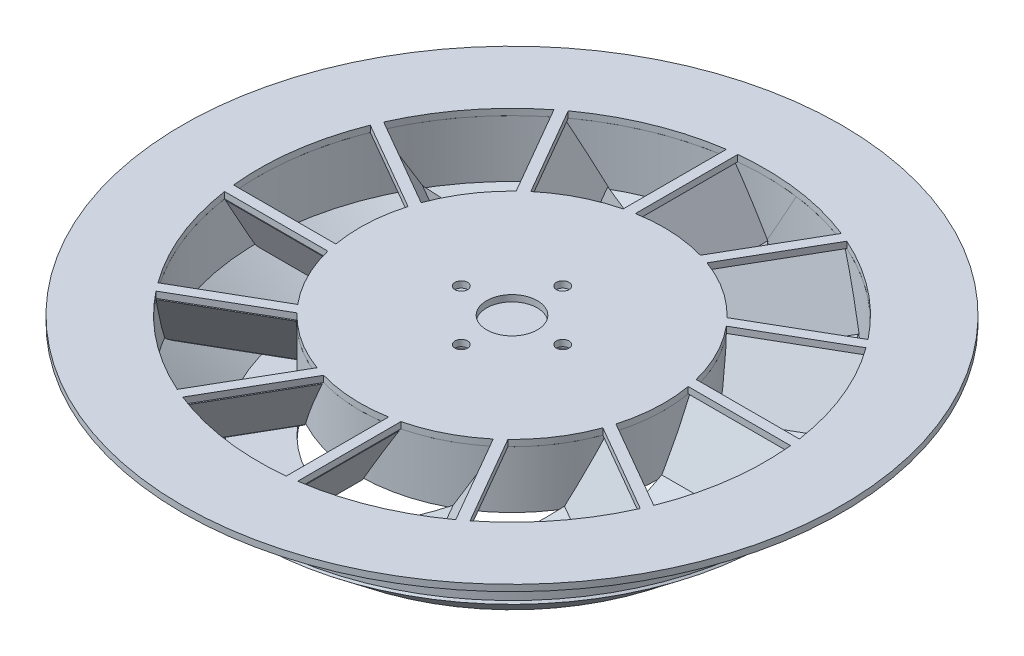
from build123d import *

# Parameters (mm, degrees)
SKETCH3_R                 = 38.1
SKETCH3_R_2               = 6.35
BOSS_EXTRUDE3_DEPTH       = 1.5875
SKETCH4_R                 = 50.8
SKETCH4_R_2               = 38.1
BOSS_EXTRUDE4_DEPTH       = 1.5875
BOSS_EXTRUDE7_DEPTH       = 0.79375
BOSS_EXTRUDE7_DEPTH_BACK  = 0.79375
CIRPATTERN1_COUNT         = 12
BOSS_EXTRUDE9_DEPTH       = 12.7
BOSS_EXTRUDE9_DEPTH_BACK  = 1.5875
SKETCH11_R                = 65.0875
SKETCH11_R_2              = 63.5
SKETCH11_R_3              = 38.1
SKETCH11_R_4              = 36.5125
BOSS_EXTRUDE10_DEPTH      = 0.79375
BOSS_EXTRUDE10_DEPTH_BACK = 0.79375
CIRPATTERN4_COUNT         = 12
SKETCH14_R                = 82.55
SKETCH14_R_2              = 6.35
BOSS_EXTRUDE12_DEPTH      = 1.5875
HOLE1_AT_2_COUNT          = 2
HOLE1_AT_2_PITCH          = 17.960512242
HOLE1_AT_3_COUNT          = 2
HOLE1_AT_3_PITCH          = 25.4
HOLE1_AT_4_COUNT          = 2
HOLE1_AT_4_PITCH          = 17.960512242


with BuildPart() as part:
    # Sketch3 → Boss-Extrude3 (new body)
    with BuildSketch(Plane(origin=(0, 0, 0), x_dir=(1, 0, 0), z_dir=(0, 1, 0))):
        Circle(SKETCH3_R)
        Circle(SKETCH3_R_2, mode=Mode.SUBTRACT)
    extrude(amount=BOSS_EXTRUDE3_DEPTH)

    # Sketch11 → Boss-Extrude9 (add, two sides: drawn at the far end of the back side and taken through both)
    # profile 1 of 2: a face of its own
    with BuildSketch(Plane(origin=(0, 1.5875, 0), x_dir=(1, 0, 0), z_dir=(0, 1, 0)).offset(-BOSS_EXTRUDE9_DEPTH_BACK)):
        Circle(SKETCH11_R)
        Circle(SKETCH11_R_2, mode=Mode.SUBTRACT)
    # profile 2 of 2: a face of its own
    with BuildSketch(Plane(origin=(0, 1.5875, 0), x_dir=(1, 0, 0), z_dir=(0, 1, 0)).offset(-BOSS_EXTRUDE9_DEPTH_BACK)):
        Circle(SKETCH11_R_3)
        Circle(SKETCH11_R_4, mode=Mode.SUBTRACT)
    extrude(amount=BOSS_EXTRUDE9_DEPTH + BOSS_EXTRUDE9_DEPTH_BACK)


with BuildPart() as body_2:
    # Sketch4 → Boss-Extrude4 (new body)
    with BuildSketch(Plane(origin=(0, -10.16, 0), x_dir=(1, 0, 0), z_dir=(0, 1, 0))):
        Circle(SKETCH4_R)
        Circle(SKETCH4_R_2, mode=Mode.SUBTRACT)
    extrude(amount=-BOSS_EXTRUDE4_DEPTH)


with BuildPart() as body_3:
    # Sketch5 → Revolve1 (revolve)
    with BuildSketch(Plane(origin=(0, 0, 0), x_dir=(0, 0, -1), z_dir=(1, 0, 0))):
        Polygon((64.491703388, -1.239629235), (63.5, 0), (50.8, -10.16), (51.791703388, -11.399629235), align=None)
    revolve(axis=Axis((0, -12.41425, 0), (0, 1, 0)))


with BuildPart() as body_4:
    # Sketch10 → Boss-Extrude7 (new, two sides: drawn at the far end of the back side and taken through both)
    with BuildSketch(Plane(origin=(0, 0, 0), x_dir=(0, 0, 1), z_dir=(0.5000000000000067, -0.8660254037844348, 0)).offset(-BOSS_EXTRUDE7_DEPTH_BACK)):
        with BuildLine():
            Line((63.5, 0), (38.1, 0))
            ThreePointArc((38.1, 0), (37.01129211, 10.38577077), (33.792502127, 20.32))
            Line((33.792502127, 20.32), (47.65462412, 20.32))
            add(Edge.make_bspline(
                [(63.5, 0), (56.244791264, 11.608333978), (47.65462412, 20.32)],
                knots=[2.377033856, 2.377033856, 2.377033856, 2.595342265, 2.595342265, 2.595342265], degree=2, weights=[1, 0.994048592, 1]))
        make_face()
    extrude(amount=BOSS_EXTRUDE7_DEPTH + BOSS_EXTRUDE7_DEPTH_BACK)


with BuildPart() as cirpattern1_1:
    # CirPattern1: pattern copy
    add(body_4.part.rotate(Axis((0, -12.41425, 0), (0, 1, 0)), 1 * 360 / CIRPATTERN1_COUNT))


with BuildPart() as cirpattern1_2:
    # CirPattern1: pattern copy
    add(body_4.part.rotate(Axis((0, -12.41425, 0), (0, 1, 0)), 2 * 360 / CIRPATTERN1_COUNT))


with BuildPart() as cirpattern1_3:
    # CirPattern1: pattern copy
    add(body_4.part.rotate(Axis((0, -12.41425, 0), (0, 1, 0)), 3 * 360 / CIRPATTERN1_COUNT))


with BuildPart() as cirpattern1_4:
    # CirPattern1: pattern copy
    add(body_4.part.rotate(Axis((0, -12.41425, 0), (0, 1, 0)), 4 * 360 / CIRPATTERN1_COUNT))


with BuildPart() as cirpattern1_5:
    # CirPattern1: pattern copy
    add(body_4.part.rotate(Axis((0, -12.41425, 0), (0, 1, 0)), 5 * 360 / CIRPATTERN1_COUNT))


with BuildPart() as cirpattern1_6:
    # CirPattern1: pattern copy
    add(body_4.part.rotate(Axis((0, -12.41425, 0), (0, 1, 0)), 6 * 360 / CIRPATTERN1_COUNT))


with BuildPart() as cirpattern1_7:
    # CirPattern1: pattern copy
    add(body_4.part.rotate(Axis((0, -12.41425, 0), (0, 1, 0)), 7 * 360 / CIRPATTERN1_COUNT))


with BuildPart() as cirpattern1_8:
    # CirPattern1: pattern copy
    add(body_4.part.rotate(Axis((0, -12.41425, 0), (0, 1, 0)), 8 * 360 / CIRPATTERN1_COUNT))


with BuildPart() as cirpattern1_9:
    # CirPattern1: pattern copy
    add(body_4.part.rotate(Axis((0, -12.41425, 0), (0, 1, 0)), 9 * 360 / CIRPATTERN1_COUNT))


with BuildPart() as cirpattern1_10:
    # CirPattern1: pattern copy
    add(body_4.part.rotate(Axis((0, -12.41425, 0), (0, 1, 0)), 10 * 360 / CIRPATTERN1_COUNT))


with BuildPart() as cirpattern1_11:
    # CirPattern1: pattern copy
    add(body_4.part.rotate(Axis((0, -12.41425, 0), (0, 1, 0)), 11 * 360 / CIRPATTERN1_COUNT))


with BuildPart() as boss_extrude9_piece_1:
    # of the separate pieces the step leaves, piece 1, a body of its own (boss_extrude9_pieces)
    add(part.part.solids().sort_by_distance((38.1, 0, 0))[0])


with BuildPart() as boss_extrude9_piece_2:
    # of the separate pieces the step leaves, piece 2, a body of its own (boss_extrude9_pieces)
    add(part.part.solids().sort_by_distance((65.0875, 1.5875, 0))[0])


with BuildPart() as body_17:
    # Sketch13 → Boss-Extrude10 (new, two sides: drawn at the far end of the back side and taken through both)
    with BuildSketch(Plane(origin=(0, 0, 0), x_dir=(0, 0, 1), z_dir=(-0.8660254037844398, 0.499999999999998, 0)).offset(-BOSS_EXTRUDE10_DEPTH_BACK)):
        with BuildLine():
            Line((37.196314082, 16.497783942), (62.961939148, 16.497783942))
            add(Edge.make_bspline(
                [(63.5, 0), (63.5, 8.283988743), (62.961939148, 16.497783942)],
                knots=[4.71238898, 4.71238898, 4.71238898, 4.842660948, 4.842660948, 4.842660948], degree=2, weights=[1, 0.997879402, 1]))
            Line((63.5, 0), (38.1, 0))
            add(Edge.make_bspline(
                [(38.1, 0), (38.1, 8.347892933), (37.196314082, 16.497783942)],
                knots=[1.570796327, 1.570796327, 1.570796327, 1.789030841, 1.789030841, 1.789030841], degree=2, weights=[1, 0.994052617, 1]))
        make_face()
    extrude(amount=BOSS_EXTRUDE10_DEPTH + BOSS_EXTRUDE10_DEPTH_BACK)


with BuildPart() as cirpattern4_1:
    # CirPattern4: pattern copy
    add(body_17.part.rotate(Axis((0, -12.41425, 0), (0, 1, 0)), 1 * 360 / CIRPATTERN4_COUNT))


with BuildPart() as cirpattern4_2:
    # CirPattern4: pattern copy
    add(body_17.part.rotate(Axis((0, -12.41425, 0), (0, 1, 0)), 2 * 360 / CIRPATTERN4_COUNT))


with BuildPart() as cirpattern4_3:
    # CirPattern4: pattern copy
    add(body_17.part.rotate(Axis((0, -12.41425, 0), (0, 1, 0)), 3 * 360 / CIRPATTERN4_COUNT))


with BuildPart() as cirpattern4_4:
    # CirPattern4: pattern copy
    add(body_17.part.rotate(Axis((0, -12.41425, 0), (0, 1, 0)), 4 * 360 / CIRPATTERN4_COUNT))


with BuildPart() as cirpattern4_5:
    # CirPattern4: pattern copy
    add(body_17.part.rotate(Axis((0, -12.41425, 0), (0, 1, 0)), 5 * 360 / CIRPATTERN4_COUNT))


with BuildPart() as cirpattern4_6:
    # CirPattern4: pattern copy
    add(body_17.part.rotate(Axis((0, -12.41425, 0), (0, 1, 0)), 6 * 360 / CIRPATTERN4_COUNT))


with BuildPart() as cirpattern4_7:
    # CirPattern4: pattern copy
    add(body_17.part.rotate(Axis((0, -12.41425, 0), (0, 1, 0)), 7 * 360 / CIRPATTERN4_COUNT))


with BuildPart() as cirpattern4_8:
    # CirPattern4: pattern copy
    add(body_17.part.rotate(Axis((0, -12.41425, 0), (0, 1, 0)), 8 * 360 / CIRPATTERN4_COUNT))


with BuildPart() as cirpattern4_9:
    # CirPattern4: pattern copy
    add(body_17.part.rotate(Axis((0, -12.41425, 0), (0, 1, 0)), 9 * 360 / CIRPATTERN4_COUNT))


with BuildPart() as cirpattern4_10:
    # CirPattern4: pattern copy
    add(body_17.part.rotate(Axis((0, -12.41425, 0), (0, 1, 0)), 10 * 360 / CIRPATTERN4_COUNT))


with BuildPart() as cirpattern4_11:
    # CirPattern4: pattern copy
    add(body_17.part.rotate(Axis((0, -12.41425, 0), (0, 1, 0)), 11 * 360 / CIRPATTERN4_COUNT))


with BuildPart() as body_29:
    # Sketch14 → Boss-Extrude12 (new body)
    with BuildSketch(Plane(origin=(0, 14.2875, 0), x_dir=(1, 0, 0), z_dir=(0, 1, 0))):
        Circle(SKETCH14_R)
        Circle(SKETCH14_R_2, mode=Mode.SUBTRACT)
        with BuildLine():
            Line((-6.608984307, 63.155136976), (-6.608984307, 37.522410989))
            ThreePointArc((-6.608984307, 37.522410989), (0.836007826, 38.09082686), (8.248891971, 37.196314082))
            ThreePointArc((8.248891971, 37.196314082), (9.413773008, 36.918706339), (10.569354385, 36.604627411))
            Line((10.569354385, 36.604627411), (23.495476005, 58.993326803))
            ThreePointArc((23.495476005, 58.993326803), (8.695893655, 62.901760178), (-6.608984307, 63.155136976))
        make_face(mode=Mode.SUBTRACT)
        with BuildLine():
            Line((-9.148984307, 62.837457668), (-9.148984307, 36.985214426))
            ThreePointArc((-9.148984307, 36.985214426), (-17.262532838, 33.964907773), (-24.484753797, 29.190868974))
            Line((-24.484753797, 29.190868974), (-37.301116791, 51.389460847))
            ThreePointArc((-37.301116791, 51.389460847), (-23.920015276, 58.822469085), (-9.148984307, 62.837457668))
        make_face(mode=Mode.SUBTRACT)
        with BuildLine():
            Line((25.854020185, 57.998445154), (13.037657192, 35.799853281))
            ThreePointArc((13.037657192, 35.799853281), (20.78320655, 31.932245858), (27.455643104, 26.415860042))
            Line((27.455643104, 26.415860042), (49.844342496, 39.341981662))
            ThreePointArc((49.844342496, 39.341981662), (38.981744903, 50.12657543), (25.854020185, 57.998445154))
        make_face(mode=Mode.SUBTRACT)
        with BuildLine():
            Line((51.389460847, 37.301116791), (29.190868974, 24.484753797))
            ThreePointArc((29.190868974, 24.484753797), (33.964907773, 17.262532838), (36.985214426, 9.148984307))
            Line((36.985214426, 9.148984307), (62.837457668, 9.148984307))
            ThreePointArc((62.837457668, 9.148984307), (58.822469085, 23.920015276), (51.389460847, 37.301116791))
        make_face(mode=Mode.SUBTRACT)
        with BuildLine():
            Line((63.155136976, 6.608984307), (37.522410989, 6.608984307))
            ThreePointArc((37.522410989, 6.608984307), (38.045739387, -2.032661915), (36.604627411, -10.569354385))
            Line((36.604627411, -10.569354385), (58.993326803, -23.495476005))
            ThreePointArc((58.993326803, -23.495476005), (62.901760178, -8.695893655), (63.155136976, 6.608984307))
        make_face(mode=Mode.SUBTRACT)
        with BuildLine():
            Line((57.998445154, -25.854020185), (35.799853281, -13.037657192))
            ThreePointArc((35.799853281, -13.037657192), (31.932245858, -20.78320655), (26.415860042, -27.455643104))
            Line((26.415860042, -27.455643104), (39.341981662, -49.844342496))
            ThreePointArc((39.341981662, -49.844342496), (50.12657543, -38.981744903), (57.998445154, -25.854020185))
        make_face(mode=Mode.SUBTRACT)
        with BuildLine():
            Line((37.301116791, -51.389460847), (24.484753797, -29.190868974))
            ThreePointArc((24.484753797, -29.190868974), (17.262532838, -33.964907773), (9.148984307, -36.985214426))
            Line((9.148984307, -36.985214426), (9.148984307, -62.837457668))
            ThreePointArc((9.148984307, -62.837457668), (23.920015276, -58.822469085), (37.301116791, -51.389460847))
        make_face(mode=Mode.SUBTRACT)
        with BuildLine():
            Line((6.608984307, -63.155136976), (6.608984307, -37.522410989))
            ThreePointArc((6.608984307, -37.522410989), (-2.032661915, -38.045739387), (-10.569354385, -36.604627411))
            Line((-10.569354385, -36.604627411), (-23.495476005, -58.993326803))
            ThreePointArc((-23.495476005, -58.993326803), (-8.695893655, -62.901760178), (6.608984307, -63.155136976))
        make_face(mode=Mode.SUBTRACT)
        with BuildLine():
            Line((-25.854020185, -57.998445154), (-13.037657192, -35.799853281))
            ThreePointArc((-13.037657192, -35.799853281), (-20.78320655, -31.932245858), (-27.455643104, -26.415860042))
            Line((-27.455643104, -26.415860042), (-49.844342496, -39.341981662))
            ThreePointArc((-49.844342496, -39.341981662), (-38.981744903, -50.12657543), (-25.854020185, -57.998445154))
        make_face(mode=Mode.SUBTRACT)
        with BuildLine():
            Line((-51.389460847, -37.301116791), (-29.190868974, -24.484753797))
            ThreePointArc((-29.190868974, -24.484753797), (-33.964907773, -17.262532838), (-36.985214426, -9.148984307))
            Line((-36.985214426, -9.148984307), (-62.837457668, -9.148984307))
            ThreePointArc((-62.837457668, -9.148984307), (-58.822469085, -23.920015276), (-51.389460847, -37.301116791))
        make_face(mode=Mode.SUBTRACT)
        with BuildLine():
            Line((-63.155136976, -6.608984307), (-37.522410989, -6.608984307))
            ThreePointArc((-37.522410989, -6.608984307), (-38.045739387, 2.032661915), (-36.604627411, 10.569354385))
            Line((-36.604627411, 10.569354385), (-58.993326803, 23.495476005))
            ThreePointArc((-58.993326803, 23.495476005), (-62.901760178, 8.695893655), (-63.155136976, -6.608984307))
        make_face(mode=Mode.SUBTRACT)
        with BuildLine():
            Line((-57.998445154, 25.854020185), (-35.799853281, 13.037657192))
            ThreePointArc((-35.799853281, 13.037657192), (-31.932245858, 20.78320655), (-26.415860042, 27.455643104))
            Line((-26.415860042, 27.455643104), (-39.341981662, 49.844342496))
            ThreePointArc((-39.341981662, 49.844342496), (-50.12657543, 38.981744903), (-57.998445154, 25.854020185))
        make_face(mode=Mode.SUBTRACT)
    extrude(amount=BOSS_EXTRUDE12_DEPTH)


with BuildPart() as hole1_tool:
    # Sketch16 → Hole1 (revolve)
    with BuildSketch(Plane(origin=(-12.7, 0, 0), x_dir=(0, 0, -1), z_dir=(1, 0, 0))):
        Polygon((0, 0), (0, 15.875), (1.5875, 15.875), (1.5875, 6.35), (3.175, 6.35), (3.175, 0), align=None)
    hole1 = revolve(axis=Axis((-12.7, 110, 0), (0, -1, 0)))


with BuildPart() as boss_extrude9_piece_1_1:
    add(boss_extrude9_piece_1.part)

    # Hole1: cut by hole1_tool
    add(hole1_tool.part, mode=Mode.SUBTRACT)


with BuildPart() as body_29_1:
    add(body_29.part)

    # Hole1: cut by hole1_tool
    add(hole1_tool.part, mode=Mode.SUBTRACT)


with BuildPart() as hole1_at_2_tool:
    # Hole1 at 2: Hole1 ×2
    with Locations(*[Vector(0.7071067811865537, 0, 0.7071067811865414) * (i * HOLE1_AT_2_PITCH) for i in range(1, HOLE1_AT_2_COUNT)]):
        add(hole1)


with BuildPart() as boss_extrude9_piece_1_2:
    add(boss_extrude9_piece_1_1.part)

    # Hole1 at 2: cut by hole1_at_2_tool
    add(hole1_at_2_tool.part, mode=Mode.SUBTRACT)


with BuildPart() as body_29_2:
    add(body_29_1.part)

    # Hole1 at 2: cut by hole1_at_2_tool
    add(hole1_at_2_tool.part, mode=Mode.SUBTRACT)


with BuildPart() as hole1_at_3_tool:
    # Hole1 at 3: Hole1 ×2
    with Locations(*[(i * HOLE1_AT_3_PITCH, 0, 0) for i in range(1, HOLE1_AT_3_COUNT)]):
        add(hole1)


with BuildPart() as boss_extrude9_piece_1_3:
    add(boss_extrude9_piece_1_2.part)

    # Hole1 at 3: cut by hole1_at_3_tool
    add(hole1_at_3_tool.part, mode=Mode.SUBTRACT)


with BuildPart() as body_29_3:
    add(body_29_2.part)

    # Hole1 at 3: cut by hole1_at_3_tool
    add(hole1_at_3_tool.part, mode=Mode.SUBTRACT)


with BuildPart() as hole1_at_4_tool:
    # Hole1 at 4: Hole1 ×2
    with Locations(*[Vector(0.7071067811865439, 0, -0.7071067811865512) * (i * HOLE1_AT_4_PITCH) for i in range(1, HOLE1_AT_4_COUNT)]):
        add(hole1)


with BuildPart() as boss_extrude9_piece_1_4:
    add(boss_extrude9_piece_1_3.part)

    # Hole1 at 4: cut by hole1_at_4_tool
    add(hole1_at_4_tool.part, mode=Mode.SUBTRACT)


with BuildPart() as body_29_4:
    add(body_29_3.part)

    # Hole1 at 4: cut by hole1_at_4_tool
    add(hole1_at_4_tool.part, mode=Mode.SUBTRACT)


solid = Compound([body_2.part, body_3.part, body_4.part, cirpattern1_1.part, cirpattern1_2.part, cirpattern1_3.part, cirpattern1_4.part, cirpattern1_5.part, cirpattern1_6.part, cirpattern1_7.part, cirpattern1_8.part, cirpattern1_9.part, cirpattern1_10.part, cirpattern1_11.part, boss_extrude9_piece_2.part, body_17.part, cirpattern4_1.part, cirpattern4_2.part, cirpattern4_3.part, cirpattern4_4.part, cirpattern4_5.part, cirpattern4_6.part, cirpattern4_7.part, cirpattern4_8.part, cirpattern4_9.part, cirpattern4_10.part, cirpattern4_11.part, boss_extrude9_piece_1_4.part, body_29_4.part])
